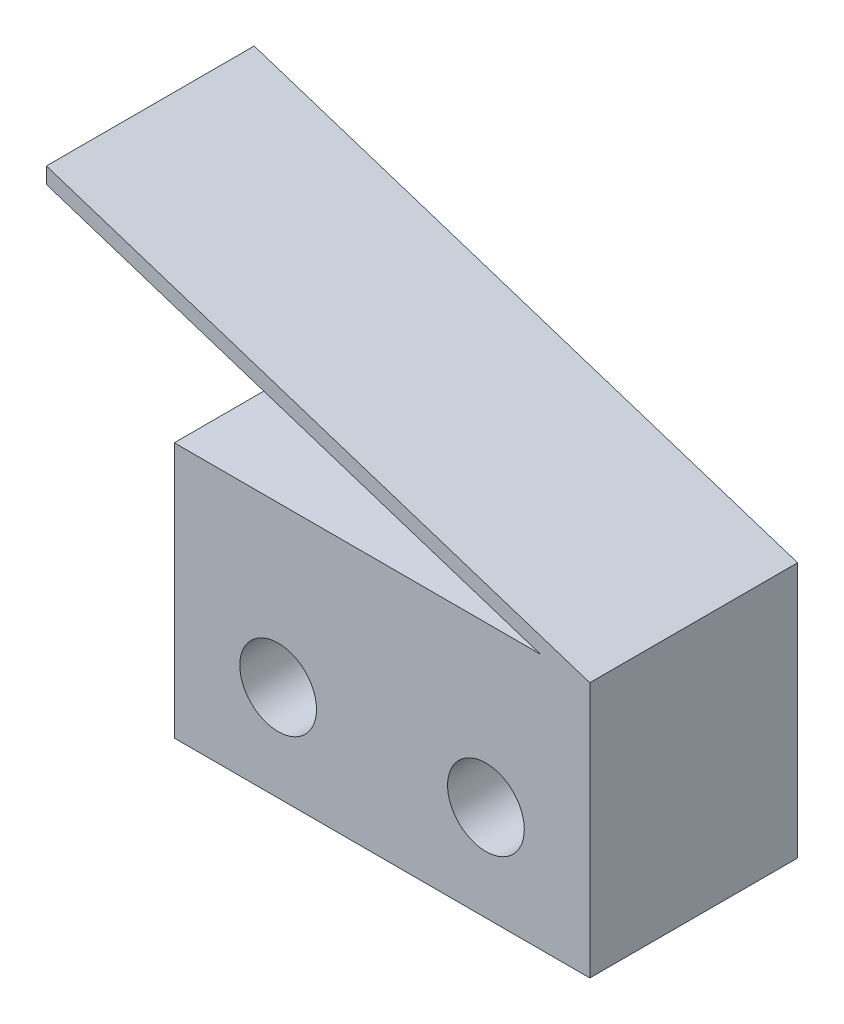
from build123d import *

# Parameters (mm, degrees)
AUFSATZ_LINEAR_AUSTRAGEN1_DEPTH = 6.5
SKIZZE2_R                       = 1.2
SCHNITT_LINEAR_AUSTRAGEN1_DEPTH = 20.836834425


with BuildPart() as part:
    # Skizze1 → Aufsatz-Linear austragen1 (new body)
    with BuildSketch(Plane.XY):
        Polygon((0, 0), (13, 0), (13, 8), (-4, 13.5), (-4, 13), (11.454545455, 8), (0, 8), align=None)
    extrude(amount=AUFSATZ_LINEAR_AUSTRAGEN1_DEPTH)

    # Skizze2 → Schnitt-Linear austragen1 (cut, through all)
    with BuildSketch(Plane.XY.offset(6.5)):
        with Locations((3.25, 3)):
            Circle(SKIZZE2_R)
        with Locations((9.75, 3)):
            Circle(SKIZZE2_R)
    extrude(amount=-SCHNITT_LINEAR_AUSTRAGEN1_DEPTH, mode=Mode.SUBTRACT)


solid = part.part
